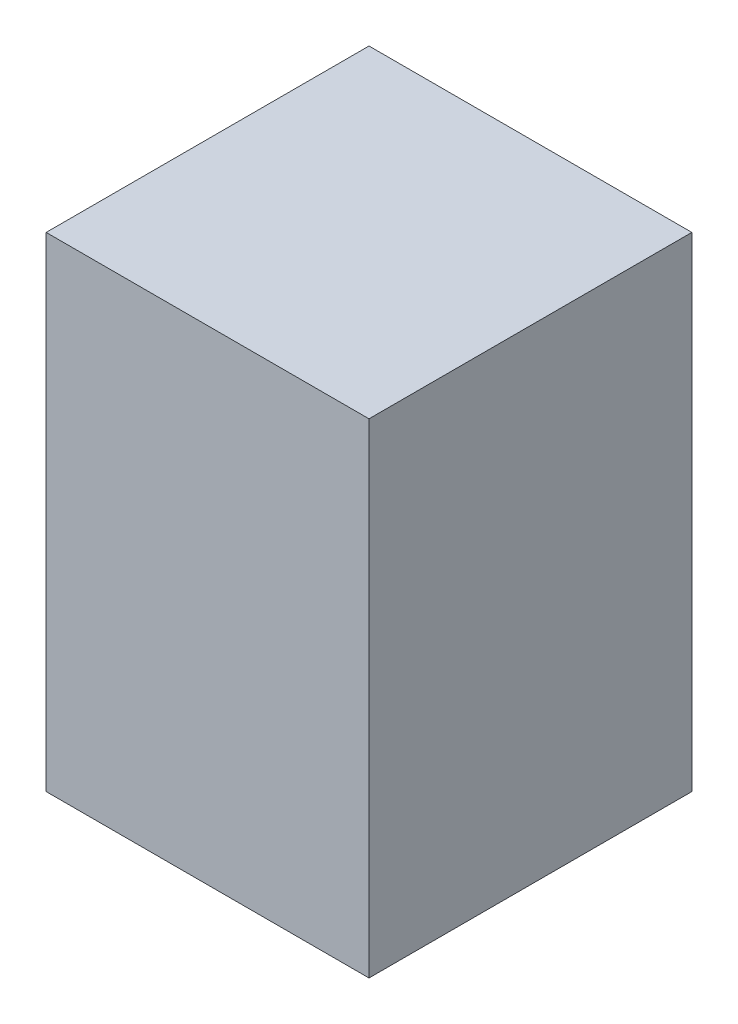
from build123d import *

# Parameters (mm, degrees)
STORE_AYAK_1_1_START = -40
SKETCH1_W            = 80
SKETCH1_H            = 120
STORE_AYAK_1_1_DEPTH = 80


with BuildPart() as part:
    # Sketch1 → STORE_ayak_1_1 (new body)
    with BuildSketch(Plane.XY.offset(STORE_AYAK_1_1_START)):
        with Locations((100, 60)):
            Rectangle(SKETCH1_W, SKETCH1_H)
    extrude(amount=-STORE_AYAK_1_1_DEPTH)


solid = part.part
